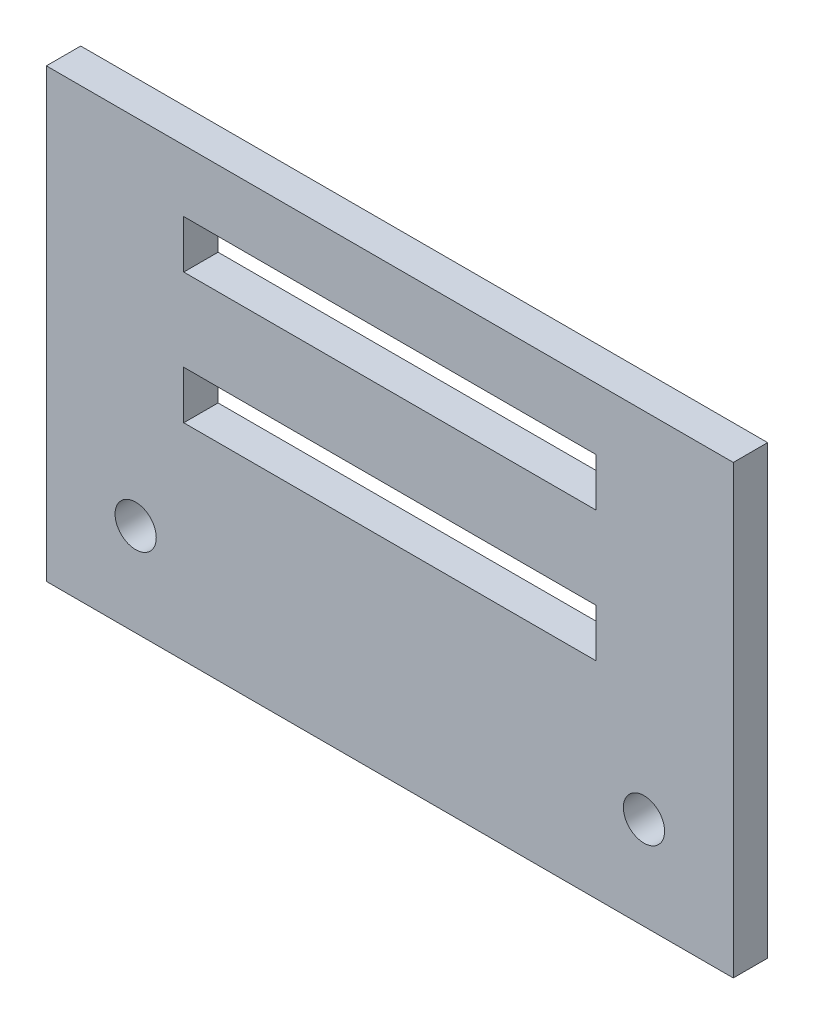
from build123d import *

# Parameters (mm, degrees)
FRAME_OUTLINE_W     = 5
FRAME_OUTLINE_H     = 3.25
FRAME_OUTLINE_R     = 0.15
FRAME_OUTLINE_W_2   = 3
FRAME_OUTLINE_H_2   = 0.35
BOSS_EXTRUDE1_DEPTH = 0.125


with BuildPart() as part:
    # frame_outline → Boss-Extrude1 (new, symmetric)
    with BuildSketch(Plane.XY):
        with Locations((2.5, 1.625)):
            Rectangle(FRAME_OUTLINE_W, FRAME_OUTLINE_H)
        with Locations((0.65, 0.675)):
            Circle(FRAME_OUTLINE_R, mode=Mode.SUBTRACT)
        with Locations((4.35, 0.675)):
            Circle(FRAME_OUTLINE_R, mode=Mode.SUBTRACT)
        with Locations((2.5, 1.675)):
            Rectangle(FRAME_OUTLINE_W_2, FRAME_OUTLINE_H_2, mode=Mode.SUBTRACT)
        with Locations((2.5, 2.625)):
            Rectangle(FRAME_OUTLINE_W_2, FRAME_OUTLINE_H_2, mode=Mode.SUBTRACT)
    extrude(amount=BOSS_EXTRUDE1_DEPTH, both=True)


solid = part.part
